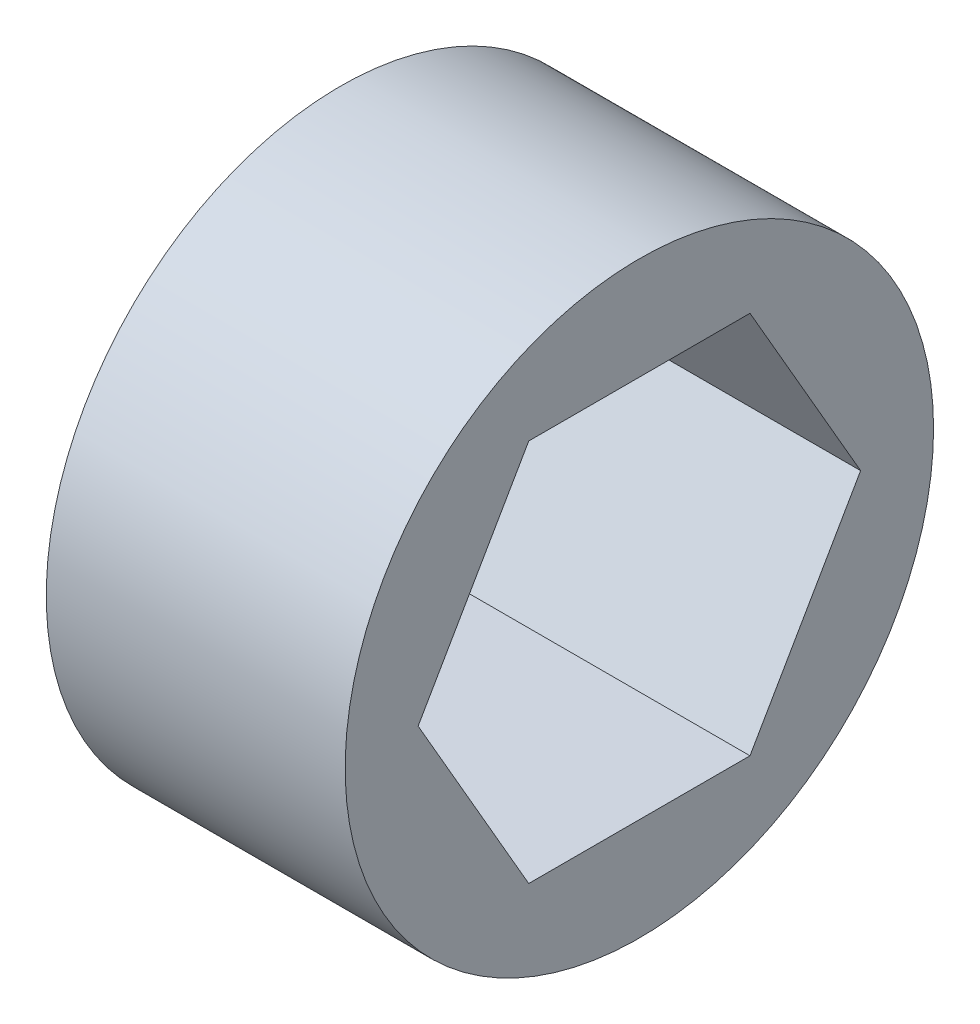
from build123d import *

# Parameters (mm, degrees)
SKETCH1_R           = 9.750000058
BOSS_EXTRUDE1_DEPTH = 9.906


with BuildPart() as part:
    # Sketch1 → Boss-Extrude1 (new body)
    with BuildSketch(Plane(origin=(0, 0, 0), x_dir=(0, 0, -1), z_dir=(1, 0, 0))):
        Circle(SKETCH1_R)
        Polygon((-3.666174209, 6.35), (-7.332348419, 0), (-3.666174209, -6.35), (3.666174209, -6.35), (7.332348419, 0), (3.666174209, 6.35), align=None, mode=Mode.SUBTRACT)
    extrude(amount=BOSS_EXTRUDE1_DEPTH)


solid = part.part
